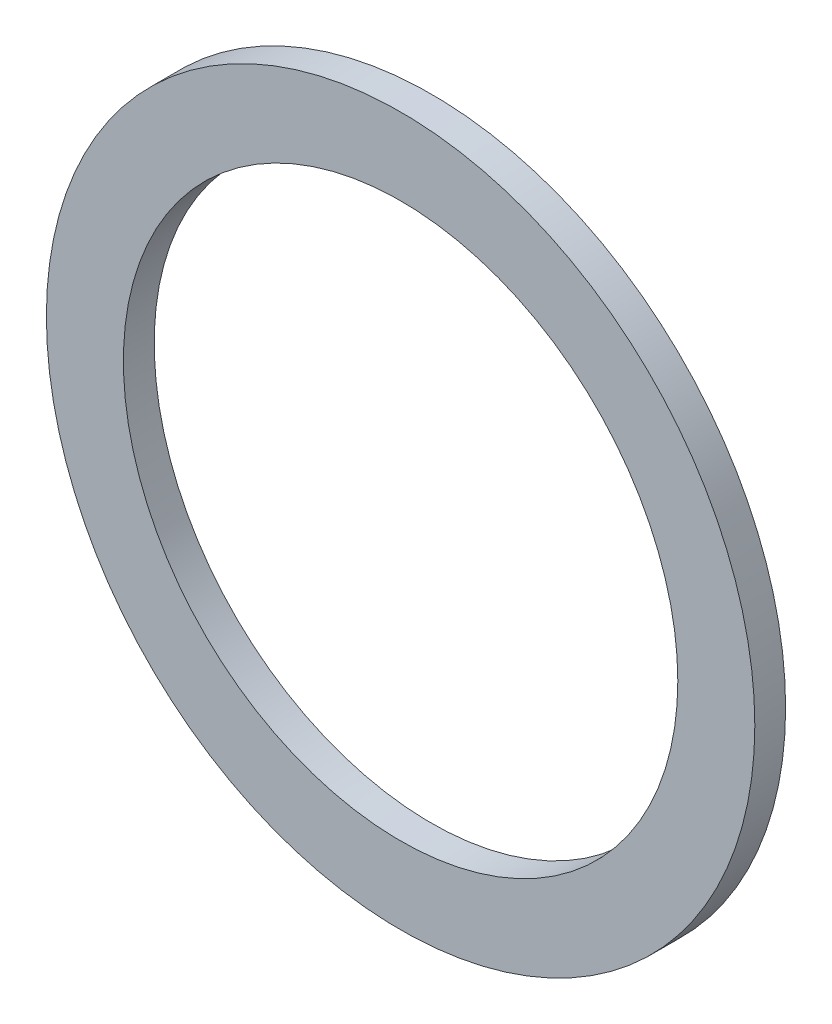
from build123d import *

# Parameters (mm, degrees)
SKETCH1_R           = 115
SKETCH1_R_2         = 90
BOSS_EXTRUDE1_DEPTH = 5


with BuildPart() as part:
    # Sketch1 → Boss-Extrude1 (new, symmetric)
    with BuildSketch(Plane.XY):
        Circle(SKETCH1_R)
        Circle(SKETCH1_R_2, mode=Mode.SUBTRACT)
    extrude(amount=BOSS_EXTRUDE1_DEPTH, both=True)


solid = part.part
